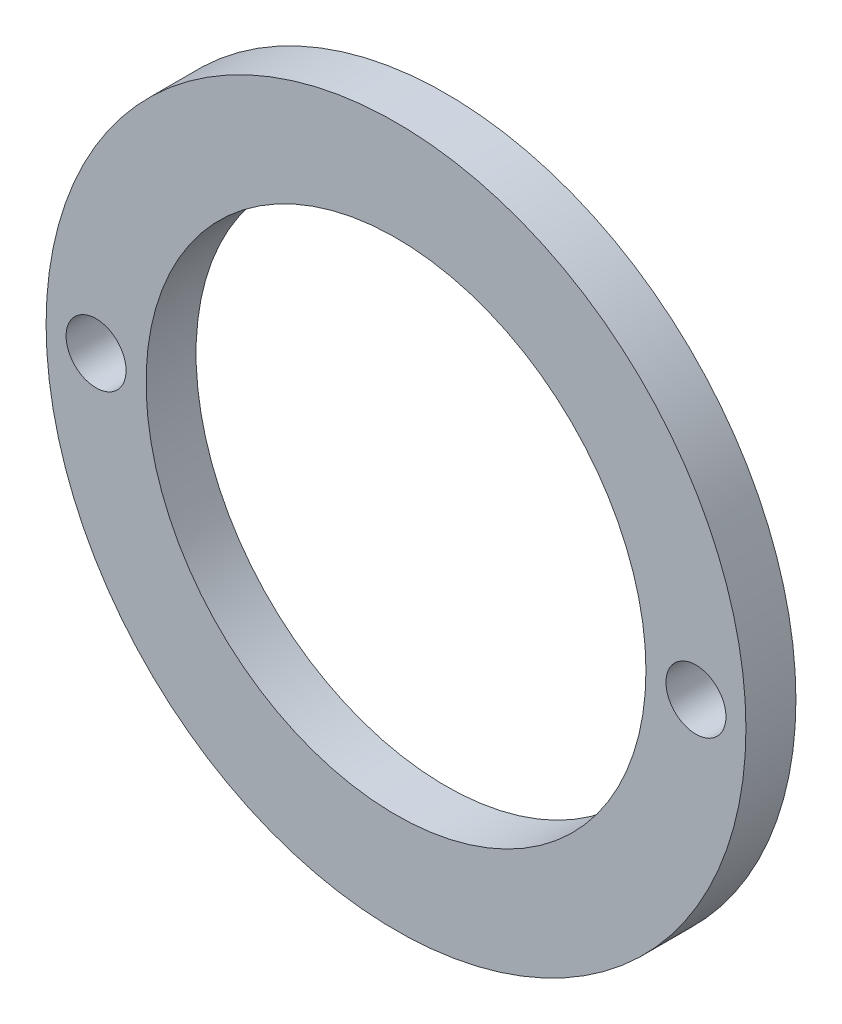
from build123d import *

# Parameters (mm, degrees)
M10X0P5_THIN_RETAINING_NUT_START = -1
SKETCH1_R                        = 7
SKETCH1_R_2                      = 5
M10X0P5_THIN_RETAINING_NUT_DEPTH = 1
SKETCH2_R                        = 0.6
TWO_PIN_WRENCH_HOLES_D1P2_DEPTH  = 10.949874371


with BuildPart() as part:
    # Sketch1 → M10x0p5_Thin_Retaining_Nut (new body)
    with BuildSketch(Plane.XY.offset(M10X0P5_THIN_RETAINING_NUT_START)):
        Circle(SKETCH1_R)
        Circle(SKETCH1_R_2, mode=Mode.SUBTRACT)
    extrude(amount=M10X0P5_THIN_RETAINING_NUT_DEPTH)

    # Sketch2 → Two_Pin_Wrench_Holes_D1p2 (cut, through all)
    with BuildSketch(Plane.XY):
        with Locations((-6, 0)):
            Circle(SKETCH2_R)
        with Locations((6, 0)):
            Circle(SKETCH2_R)
    extrude(amount=-TWO_PIN_WRENCH_HOLES_D1P2_DEPTH, mode=Mode.SUBTRACT)


solid = part.part
